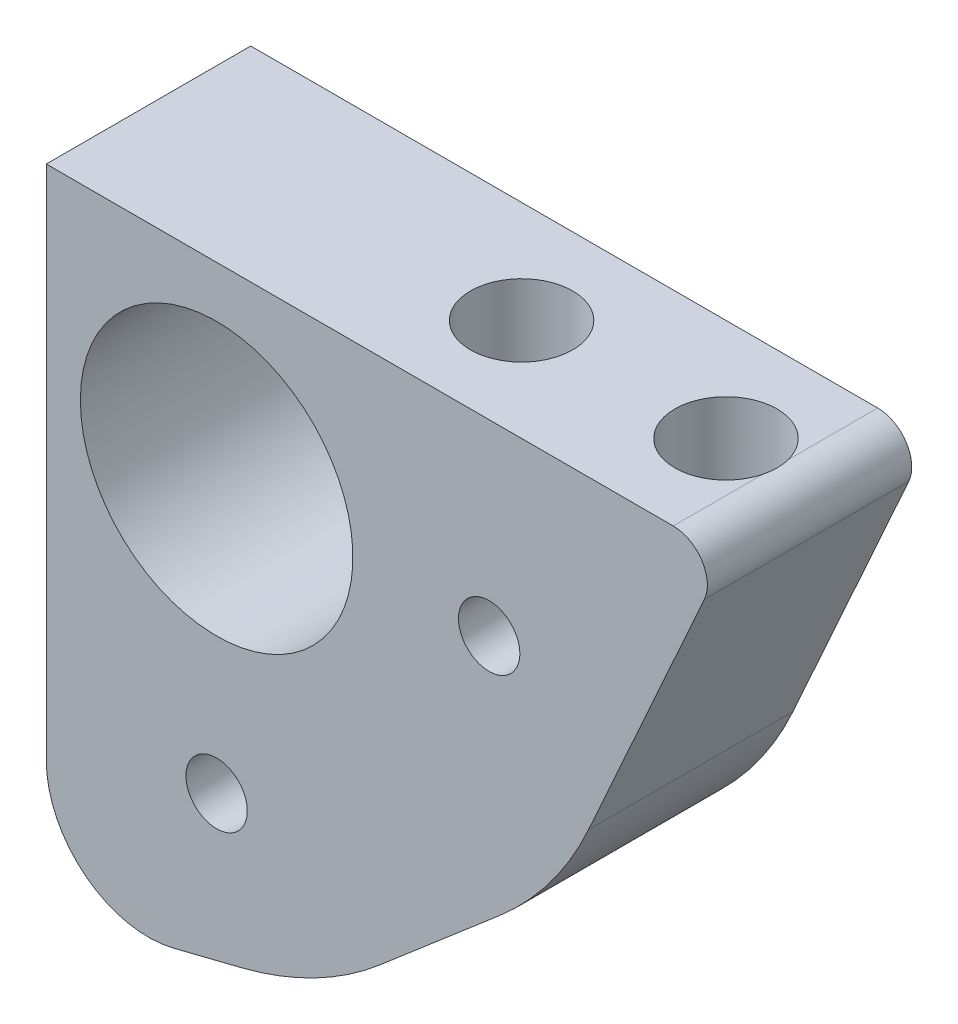
from build123d import *

# Parameters (mm, degrees)
BOSS_EXTRU_1_DEPTH      = 6
ESQUISSE5_R             = 4
ESQUISSE5_R_2           = 0.9
ENL_V_MAT_EXTRU_1_DEPTH = 18.390190711
CONG_3_R                = 10
CONG_4_R                = 3
CONG_5_R                = 1
ESQUISSE10_R            = 1.5
ENL_V_MAT_EXTRU_7_DEPTH = 3


with BuildPart() as part:
    # Esquisse2 → Boss.-Extru.1 (new body)
    with BuildSketch(Plane.XY):
        Polygon((-7.317378298, -8.665499885), (0.682621702, -6.665499885), (7.682621702, -0.665499885), (12.633955847, 10.334500115), (7.682621702, 10.334500115), (-7.317378298, 10.334500115), align=None)
    extrude(amount=BOSS_EXTRU_1_DEPTH)

    # Esquisse5 → Enlèv. mat.-Extru.1 (cut, through all)
    with BuildSketch(Plane(origin=(0, 0, 0), x_dir=(-1, 0, 0), z_dir=(0, 0, -1))):
        with Locations((2.317378298, 4.834500115)):
            Circle(ESQUISSE5_R)
        with Locations((-5.682621702, 4.834500115)):
            Circle(ESQUISSE5_R_2)
        with Locations((2.317378298, -3.165499885)):
            Circle(ESQUISSE5_R_2)
    extrude(amount=-ENL_V_MAT_EXTRU_1_DEPTH, mode=Mode.SUBTRACT)

    # Congé3
    cong_3_edges = [part.edges().sort_by_distance(p)[0] for p in [
        (7.682621702, -0.665499885, 3),
        (0.682621702, -6.665499885, 3),
    ]]
    fillet(cong_3_edges, radius=CONG_3_R)

    # Congé4
    cong_4_edges = [part.edges().sort_by_distance(p)[0] for p in [
        (-7.317378298, -8.665499885, 3),
    ]]
    fillet(cong_4_edges, radius=CONG_4_R)

    # Congé5
    cong_5_edges = [part.edges().sort_by_distance(p)[0] for p in [
        (12.633955847, 10.334500115, 3),
    ]]
    fillet(cong_5_edges, radius=CONG_5_R)

    # Esquisse10 → Enlèv. mat.-Extru.7 (cut)
    with BuildSketch(Plane(origin=(0, 10.334500115, 0), x_dir=(1, 0, 0), z_dir=(0, 1, 0))):
        with Locations(Location((3.633955847, -3, 0), (0, 0, 180))):
            Circle(ESQUISSE10_R)
        with Locations(Location((9.633955847, -3, 0), (0, 0, 180))):
            Circle(ESQUISSE10_R)
    extrude(amount=-ENL_V_MAT_EXTRU_7_DEPTH, mode=Mode.SUBTRACT)


solid = part.part
